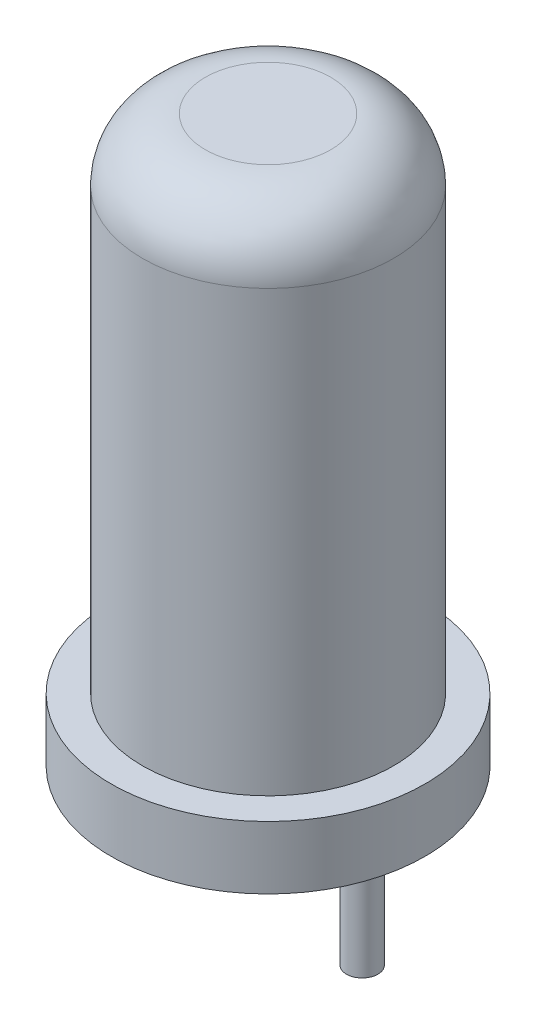
from build123d import *

# Parameters (mm, degrees)
SKETCH2_R           = 0.25
BOSS_EXTRUDE1_DEPTH = 2


with BuildPart() as part:
    # Sketch1 → Revolve1 (revolve)
    with BuildSketch(Plane.XY, mode=Mode.PRIVATE) as revolve1_sk:
        with BuildLine():
            Line((0, 0), (0, 9))
            Line((0, 9), (-1, 9))
            ThreePointArc((-1, 9), (-1.707106781, 8.707106781), (-2, 8))
            Line((-2, 8), (-2, 6))
            Line((-2, 6), (-2, 1))
            Line((-2, 1), (-2.5, 1))
            Line((-2.5, 1), (-2.5, 0))
            Line((-2.5, 0), (0, 0))
        make_face()
    revolve(revolve1_sk.sketch.rotate(Axis((0, 0, 0), (0, 1, 0)), 270), axis=Axis((0, 0, 0), (0, 1, 0)))

    # Sketch2 → Boss-Extrude1 (add)
    with BuildSketch(Plane.XZ):
        with Locations(Location((1.5, 0, 0), (0, 0, 90))):
            Circle(SKETCH2_R)
        with Locations(Location((-1.5, 0, 0), (0, 0, 90))):
            Circle(SKETCH2_R)
    extrude(amount=BOSS_EXTRUDE1_DEPTH)


solid = part.part
